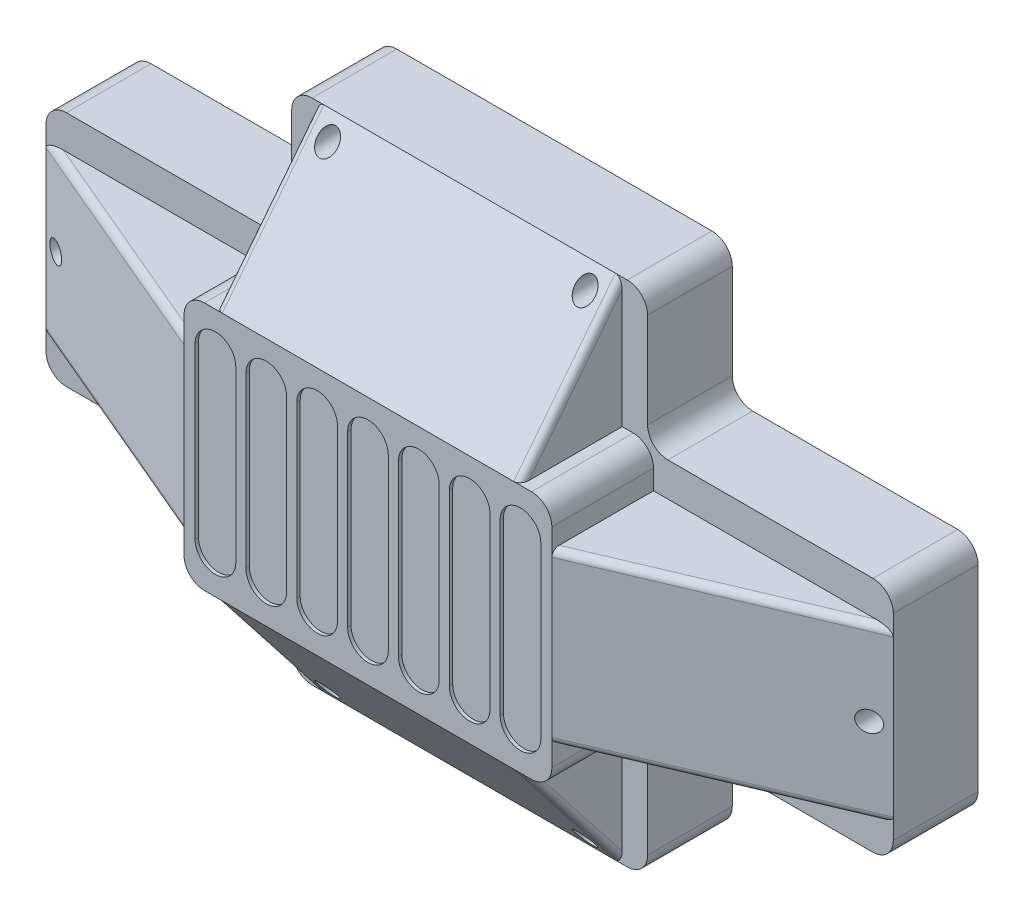
from build123d import *

# Parameters (mm, degrees)
BOSS_EXTRUDE1_DEPTH  = 25
CUT_EXTRUDE1_DEPTH   = 23
BOSS_EXTRUDE2_DEPTH  = 30
RIB5_REACH           = 157.804
SKETCH9_WALL_W       = 390.44961144
SKETCH9_WALL_H       = 50
FILLET2_R            = 2
FILLET3_R            = 2
FILLET2_OF_MIRROR1_R = 2
FILLET3_OF_MIRROR1_R = 2
RIB6_REACH           = 157.804
SKETCH10_WALL_W      = 362.214279798
SKETCH10_WALL_H      = 90
FILLET4_R            = 2
FILLET4_OF_MIRROR3_R = 2
SKETCH11_W           = 95
SKETCH11_H           = 63
CUT_EXTRUDE2_DEPTH   = 30
CUT_EXTRUDE3_DEPTH   = 1
SKETCH14_R           = 9
CUT_EXTRUDE4_DEPTH   = 5
FILLET6_R            = 3
FILLET7_R            = 3
CUT_EXTRUDE5_REACH   = 157.804
SKETCH21_R           = 3


with BuildPart() as part:
    # Sketch1 → Boss-Extrude1 (new body)
    with BuildSketch(Plane.XY):
        with BuildLine():
            Line((-119, 35), (-58.5, 35))
            ThreePointArc((-58.5, 35), (-54.257359313, 36.757359313), (-52.5, 41))
            Line((-52.5, 41), (-52.5, 69))
            ThreePointArc((-52.5, 69), (-50.742640687, 73.242640687), (-46.5, 75))
            Line((-46.5, 75), (46.5, 75))
            ThreePointArc((46.5, 75), (50.742640687, 73.242640687), (52.5, 69))
            Line((52.5, 69), (52.5, 41))
            ThreePointArc((52.5, 41), (54.257359313, 36.757359313), (58.5, 35))
            Line((58.5, 35), (119, 35))
            ThreePointArc((119, 35), (123.242640687, 33.242640687), (125, 29))
            Line((125, 29), (125, -29))
            ThreePointArc((125, -29), (123.242640687, -33.242640687), (119, -35))
            Line((119, -35), (58.5, -35))
            ThreePointArc((58.5, -35), (54.257359313, -36.757359313), (52.5, -41))
            Line((52.5, -41), (52.5, -69))
            ThreePointArc((52.5, -69), (50.742640687, -73.242640687), (46.5, -75))
            Line((46.5, -75), (-46.5, -75))
            ThreePointArc((-46.5, -75), (-50.742640687, -73.242640687), (-52.5, -69))
            Line((-52.5, -69), (-52.5, -41))
            ThreePointArc((-52.5, -41), (-54.257359313, -36.757359313), (-58.5, -35))
            Line((-58.5, -35), (-119, -35))
            ThreePointArc((-119, -35), (-123.242640687, -33.242640687), (-125, -29))
            Line((-125, -29), (-125, 29))
            ThreePointArc((-125, 29), (-123.242640687, 33.242640687), (-119, 35))
        make_face()
    extrude(amount=BOSS_EXTRUDE1_DEPTH)

    # Sketch2 → Cut-Extrude1 (cut)
    with BuildSketch(Plane(origin=(0, 0, 0), x_dir=(-1, 0, 0), z_dir=(0, 0, -1))):
        with BuildLine():
            Line((41.5, -65), (-41.5, -65))
            ThreePointArc((-41.5, -65), (-45.742640687, -63.242640687), (-47.5, -59))
            Line((-47.5, -59), (-47.5, -37.5))
            ThreePointArc((-47.5, -37.5), (-49.257359313, -33.257359313), (-53.5, -31.5))
            Line((-53.5, -31.5), (-108.997872355, -31.5))
            ThreePointArc((-108.997872355, -31.5), (-113.240513042, -29.742640687), (-114.997872355, -25.5))
            Line((-114.997872355, -25.5), (-114.997872355, 25.5))
            ThreePointArc((-114.997872355, 25.5), (-113.240513042, 29.742640687), (-108.997872355, 31.5))
            Line((-108.997872355, 31.5), (-53.5, 31.5))
            ThreePointArc((-53.5, 31.5), (-49.257359313, 33.257359313), (-47.5, 37.5))
            Line((-47.5, 37.5), (-47.5, 59))
            ThreePointArc((-47.5, 59), (-45.742640687, 63.242640687), (-41.5, 65))
            Line((-41.5, 65), (41.5, 65))
            ThreePointArc((41.5, 65), (45.742640687, 63.242640687), (47.5, 59))
            Line((47.5, 59), (47.5, 37.5))
            ThreePointArc((47.5, 37.5), (49.257359313, 33.257359313), (53.5, 31.5))
            Line((53.5, 31.5), (108.997872355, 31.5))
            ThreePointArc((108.997872355, 31.5), (113.240513042, 29.742640687), (114.997872355, 25.5))
            Line((114.997872355, 25.5), (114.997872355, -25.5))
            ThreePointArc((114.997872355, -25.5), (113.240513042, -29.742640687), (108.997872355, -31.5))
            Line((108.997872355, -31.5), (53.5, -31.5))
            ThreePointArc((53.5, -31.5), (49.257359313, -33.257359313), (47.5, -37.5))
            Line((47.5, -37.5), (47.5, -59))
            ThreePointArc((47.5, -59), (45.742640687, -63.242640687), (41.5, -65))
        make_face()
    extrude(amount=-CUT_EXTRUDE1_DEPTH, mode=Mode.SUBTRACT)

    # Sketch3 → Boss-Extrude2 (add)
    with BuildSketch(Plane.XY.offset(25)):
        with BuildLine():
            Line((-48.257359313, 36.757359313), (48.257359313, 36.757359313))
            ThreePointArc((48.257359313, 36.757359313), (52.5, 35), (54.257359313, 30.757359313))
            Line((54.257359313, 30.757359313), (54.257359313, -30.757359313))
            ThreePointArc((54.257359313, -30.757359313), (52.5, -35), (48.257359313, -36.757359313))
            Line((48.257359313, -36.757359313), (-48.257359313, -36.757359313))
            ThreePointArc((-48.257359313, -36.757359313), (-52.5, -35), (-54.257359313, -30.757359313))
            Line((-54.257359313, -30.757359313), (-54.257359313, 30.757359313))
            ThreePointArc((-54.257359313, 30.757359313), (-52.5, 35), (-48.257359313, 36.757359313))
        make_face()
    extrude(amount=BOSS_EXTRUDE2_DEPTH)

    # Sketch9 wall → Rib5 (add, up to next)
    with BuildSketch(Plane(origin=(-89.628679656, 0, 40), x_dir=(0.920638056948, 0, 0.390417171881), z_dir=(0.390417171881, 0, -0.920638056948)), mode=Mode.PRIVATE) as rib5_sk1:
        Rectangle(SKETCH9_WALL_W, SKETCH9_WALL_H)
    rib5_tool1 = extrude(rib5_sk1.sketch, amount=RIB5_REACH, mode=Mode.PRIVATE) - part.part
    rib5 = rib5_tool1.solids().sort_by_distance((-89.628679656, 0, 40))[0]
    add(rib5)

    # Fillet2
    fillet2_edges = [part.edges().sort_by_distance(p)[0] for p in [
        (-89.628679656, -25, 40),
    ]]
    fillet(fillet2_edges, radius=FILLET2_R)

    # Fillet3
    fillet3_edges = [part.edges().sort_by_distance(p)[0] for p in [
        (-89.628679656, 25, 40),
    ]]
    fillet(fillet3_edges, radius=FILLET3_R)

    # Mirror1: Rib5 across plane
    add(rib5.mirror(Plane(origin=(0, 0, 0), x_dir=(0, 0, 1), z_dir=(1, 0, 0))))

    # Fillet2 of Mirror1
    fillet2_of_mirror1_edges = [part.edges().sort_by_distance(p)[0] for p in [
        (89.628679656, -25, 40),
    ]]
    fillet(fillet2_of_mirror1_edges, radius=FILLET2_OF_MIRROR1_R)

    # Fillet3 of Mirror1
    fillet3_of_mirror1_edges = [part.edges().sort_by_distance(p)[0] for p in [
        (89.628679656, 25, 40),
    ]]
    fillet(fillet3_of_mirror1_edges, radius=FILLET3_OF_MIRROR1_R)

    # Sketch10 wall → Rib6 (add, up to next)
    with BuildSketch(Plane(origin=(0, 55.878679656, 40), x_dir=(0, 0.78679574807, -0.617213456447), z_dir=(0, 0.617213456447, 0.78679574807)), mode=Mode.PRIVATE) as rib6_sk1:
        Rectangle(SKETCH10_WALL_W, SKETCH10_WALL_H)
    rib6_tool1 = extrude(rib6_sk1.sketch, amount=-RIB6_REACH, mode=Mode.PRIVATE) - part.part
    rib6 = rib6_tool1.solids().sort_by_distance((0, 55.878679656, 40))[0]
    add(rib6)

    # Fillet4
    fillet4_edges = [part.edges().sort_by_distance(p)[0] for p in [
        (45, 55.878679656, 40),
        (-45, 55.878679656, 40),
    ]]
    fillet(fillet4_edges, radius=FILLET4_R)

    # Mirror3: Rib6 across plane
    add(rib6.mirror(Plane.ZX))

    # Fillet4 of Mirror3
    fillet4_of_mirror3_edges = [part.edges().sort_by_distance(p)[0] for p in [
        (45, -55.878679656, 40),
        (-45, -55.878679656, 40),
    ]]
    fillet(fillet4_of_mirror3_edges, radius=FILLET4_OF_MIRROR3_R)

    # Sketch11 → Cut-Extrude2 (cut)
    with BuildSketch(Plane(origin=(0, 0, 23), x_dir=(-1, 0, 0), z_dir=(0, 0, -1))):
        Rectangle(SKETCH11_W, SKETCH11_H)
    extrude(amount=-CUT_EXTRUDE2_DEPTH, mode=Mode.SUBTRACT)

    # Sketch12 → Cut-Extrude3 (cut)
    with BuildSketch(Plane.XY.offset(55)):
        with BuildLine():
            Line((6, 25), (6, -25))
            ThreePointArc((6, -25), (0, -31), (-6, -25))
            Line((-6, -25), (-6, 25))
            ThreePointArc((-6, 25), (0, 31), (6, 25))
        make_face()
        with BuildLine():
            Line((21, 25), (21, -25))
            ThreePointArc((21, -25), (15, -31), (9, -25))
            Line((9, -25), (9, 25))
            ThreePointArc((9, 25), (15, 31), (21, 25))
        make_face()
        with BuildLine():
            Line((36, 25), (36, -25))
            ThreePointArc((36, -25), (30, -31), (24, -25))
            Line((24, -25), (24, 25))
            ThreePointArc((24, 25), (30, 31), (36, 25))
        make_face()
        with BuildLine():
            Line((51, 25), (51, -25))
            ThreePointArc((51, -25), (45, -31), (39, -25))
            Line((39, -25), (39, 25))
            ThreePointArc((39, 25), (45, 31), (51, 25))
        make_face()
        with BuildLine():
            Line((-51, 25), (-51, -25))
            ThreePointArc((-51, -25), (-45, -31), (-39, -25))
            Line((-39, -25), (-39, 25))
            ThreePointArc((-39, 25), (-45, 31), (-51, 25))
        make_face()
        with BuildLine():
            Line((-36, 25), (-36, -25))
            ThreePointArc((-36, -25), (-30, -31), (-24, -25))
            Line((-24, -25), (-24, 25))
            ThreePointArc((-24, 25), (-30, 31), (-36, 25))
        make_face()
        with BuildLine():
            Line((-21, 25), (-21, -25))
            ThreePointArc((-21, -25), (-15, -31), (-9, -25))
            Line((-9, -25), (-9, 25))
            ThreePointArc((-9, 25), (-15, 31), (-21, 25))
        make_face()
    extrude(amount=-CUT_EXTRUDE3_DEPTH, mode=Mode.SUBTRACT)

    # Sketch14 → Cut-Extrude4 (cut)
    with BuildSketch(Plane.ZY.offset(125)):
        with Locations((12.5, 14)):
            Circle(SKETCH14_R)
        with Locations((12.5, -14)):
            Circle(SKETCH14_R)
    extrude(amount=-CUT_EXTRUDE4_DEPTH, mode=Mode.SUBTRACT)

    # Fillet6
    fillet6_edges = [part.edges().sort_by_distance(p)[0] for p in [
        (-120, 14, 3.5),
    ]]
    fillet(fillet6_edges, radius=FILLET6_R)

    # Fillet7
    fillet7_edges = [part.edges().sort_by_distance(p)[0] for p in [
        (-120, -14, 3.5),
    ]]
    fillet(fillet7_edges, radius=FILLET7_R)

    # Sketch21 → Cut-Extrude5 (cut, up to next)
    with BuildSketch(Plane.XY.offset(55), mode=Mode.PRIVATE) as cut_extrude5_sk1:
        with Locations((-38, 70)):
            Circle(SKETCH21_R)
    cut_extrude5_tool1 = extrude(cut_extrude5_sk1.sketch, amount=-CUT_EXTRUDE5_REACH, mode=Mode.PRIVATE) & part.part
    # Sketch21 → Cut-Extrude5 (cut, up to next)
    with BuildSketch(Plane.XY.offset(55), mode=Mode.PRIVATE) as cut_extrude5_sk2:
        with Locations((38, 70)):
            Circle(SKETCH21_R)
    cut_extrude5_tool2 = extrude(cut_extrude5_sk2.sketch, amount=-CUT_EXTRUDE5_REACH, mode=Mode.PRIVATE) & part.part
    # Sketch21 → Cut-Extrude5 (cut, up to next)
    with BuildSketch(Plane.XY.offset(55), mode=Mode.PRIVATE) as cut_extrude5_sk3:
        with Locations((38, -70)):
            Circle(SKETCH21_R)
    cut_extrude5_tool3 = extrude(cut_extrude5_sk3.sketch, amount=-CUT_EXTRUDE5_REACH, mode=Mode.PRIVATE) & part.part
    # Sketch21 → Cut-Extrude5 (cut, up to next)
    with BuildSketch(Plane.XY.offset(55), mode=Mode.PRIVATE) as cut_extrude5_sk4:
        with Locations((-38, -70)):
            Circle(SKETCH21_R)
    cut_extrude5_tool4 = extrude(cut_extrude5_sk4.sketch, amount=-CUT_EXTRUDE5_REACH, mode=Mode.PRIVATE) & part.part
    # Sketch21 → Cut-Extrude5 (cut, up to next)
    with BuildSketch(Plane.XY.offset(55), mode=Mode.PRIVATE) as cut_extrude5_sk5:
        with Locations((-120, 0)):
            Circle(SKETCH21_R)
    cut_extrude5_tool5 = extrude(cut_extrude5_sk5.sketch, amount=-CUT_EXTRUDE5_REACH, mode=Mode.PRIVATE) & part.part
    # Sketch21 → Cut-Extrude5 (cut, up to next)
    with BuildSketch(Plane.XY.offset(55), mode=Mode.PRIVATE) as cut_extrude5_sk6:
        with Locations((120, 0)):
            Circle(SKETCH21_R)
    cut_extrude5_tool6 = extrude(cut_extrude5_sk6.sketch, amount=-CUT_EXTRUDE5_REACH, mode=Mode.PRIVATE) & part.part
    add(cut_extrude5_tool1.solids().sort_by_distance((-38, 70, 55))[0], mode=Mode.SUBTRACT)
    add(cut_extrude5_tool2.solids().sort_by_distance((38, 70, 55))[0], mode=Mode.SUBTRACT)
    add(cut_extrude5_tool3.solids().sort_by_distance((38, -70, 55))[0], mode=Mode.SUBTRACT)
    add(cut_extrude5_tool4.solids().sort_by_distance((-38, -70, 55))[0], mode=Mode.SUBTRACT)
    add(cut_extrude5_tool5.solids().sort_by_distance((-120, 0, 55))[0], mode=Mode.SUBTRACT)
    add(cut_extrude5_tool6.solids().sort_by_distance((120, 0, 55))[0], mode=Mode.SUBTRACT)


solid = part.part
